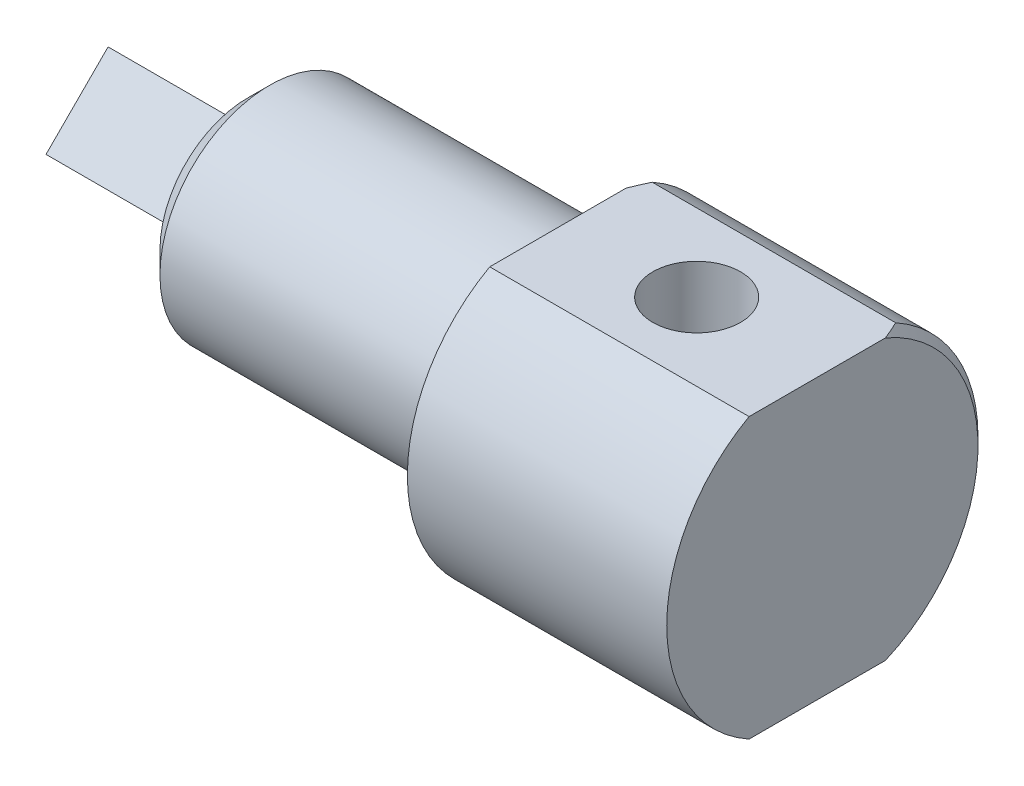
from build123d import *

# Parameters (mm, degrees)
EXTRUDE_1_DEPTH          = 35
SKETCH_4_W               = 45
SKETCH_4_H               = 5
CUT_EXTRUDE_1_DEPTH      = 8
CUT_EXTRUDE_2_DEPTH      = 189.679622641
CUT_EXTRUDE_3_DEPTH      = 166.90660023
CUT_EXTRUDE_3_DEPTH_BACK = 166.90660023
SKETCH_6_R               = 11
CHAMFER_1_SIZE           = 2
CHAMFER_2_SIZE           = 5.5


with BuildPart() as part:
    # Эскиз1 → Повернуть1 (revolve)
    with BuildSketch(Plane.XY, mode=Mode.PRIVATE) as revolve_1_sk:
        Polygon((0, 0), (0, 27.5), (80, 27.5), (80, 40), (145, 40), (145, 0), align=None)
    revolve(revolve_1_sk.sketch.rotate(Axis((0, 0, 0), (-1, 0, 0)), 90), axis=Axis((0, 0, 0), (-1, 0, 0)))

    # Эскиз3 → Бобышка-Вытянуть1 (add)
    with BuildSketch(Plane.ZY):
        Polygon((0, -15.556349186), (-15.556349186, 0), (0, 15.556349186), (15.556349186, 0), align=None)
    extrude(amount=EXTRUDE_1_DEPTH)

    # Эскиз4 → Вырез-Вытянуть1 (cut, symmetric)
    with BuildSketch(Plane(origin=(0, 0, 0), x_dir=(1, 0, 0), z_dir=(0, 1, 0))):
        with Locations((37.5, 25)):
            Rectangle(SKETCH_4_W, SKETCH_4_H)
    extrude(amount=CUT_EXTRUDE_1_DEPTH, both=True, mode=Mode.SUBTRACT)

    # Эскиз5 → Вырез-Вытянуть2 (cut, symmetric)
    with BuildSketch(Plane(origin=(145, 0, 0), x_dir=(0, 0, -1), z_dir=(1, 0, 0))):
        Polygon((-220.667748268, 35), (-19.364916731, 35), (19.364916731, 35), (220.667748268, 35), (220.667748268, 437.605663073), (-220.667748268, 437.605663073), align=None)
    cut_extrude_2 = extrude(amount=CUT_EXTRUDE_2_DEPTH, both=True, mode=Mode.SUBTRACT)

    # Зеркальное отражение1: Вырез-Вытянуть2 across plane
    add(cut_extrude_2.mirror(Plane.ZX), mode=Mode.SUBTRACT)

    # Эскиз6 → Вырез-Вытянуть3 (cut, two sides: drawn at the far end of the back side and taken through both)
    with BuildSketch(Plane(origin=(0, 35, 0), x_dir=(1, 0, 0), z_dir=(0, 1, 0)).offset(-CUT_EXTRUDE_3_DEPTH_BACK)):
        with Locations(Location((112.5, 0, 0), (0, 0, 270))):
            Circle(SKETCH_6_R)
    extrude(amount=CUT_EXTRUDE_3_DEPTH + CUT_EXTRUDE_3_DEPTH_BACK, mode=Mode.SUBTRACT)

    # Фаска1
    chamfer_1_edges = [part.edges().sort_by_distance(p)[0] for p in [
        (145, 0, -40),
        (80, 0, -40),
    ]]
    chamfer(chamfer_1_edges, length=CHAMFER_1_SIZE)

    # Фаска2
    chamfer_2_edges = [part.edges().sort_by_distance(p)[0] for p in [
        (0, 0, 27.5),
    ]]
    chamfer(chamfer_2_edges, length=CHAMFER_2_SIZE)


solid = part.part
